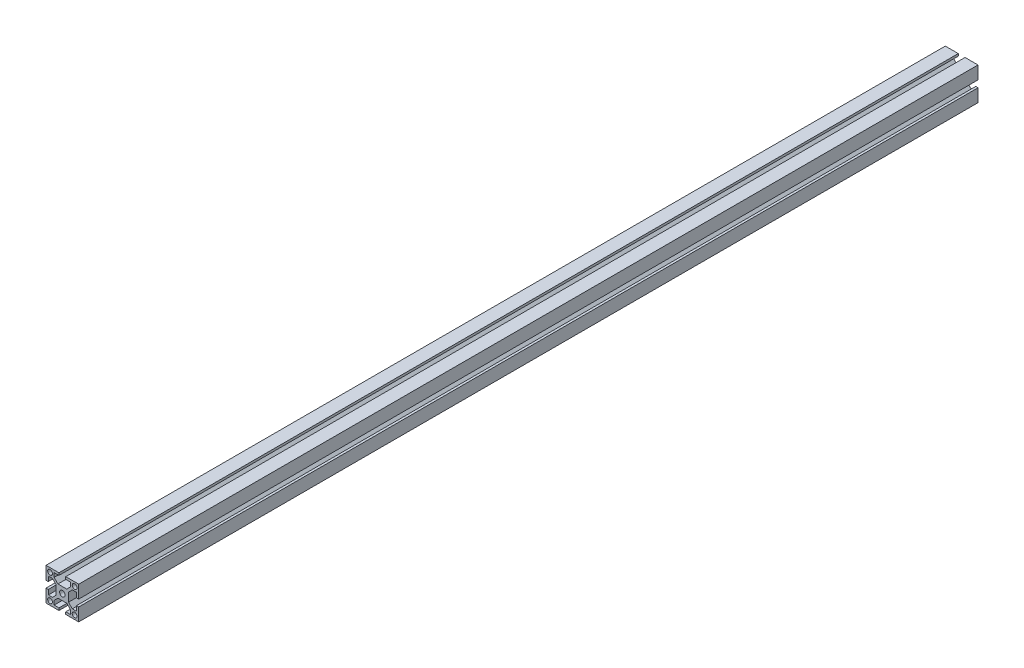
from build123d import *

# Parameters (mm, degrees)
SKETCH_1_R      = 3.4
SKETCH_1_R_2    = 2.95
EXTRUDE_1_DEPTH = 1100


with BuildPart() as part:
    # 草图1 → 凸台-拉伸1 (new body)
    with BuildSketch(Plane.XY):
        Polygon((-19.086731265, -5.57298703), (-8.329371952, -5.57298703), (-3.658051608, -10.244307374), (-3.658051608, -15.27298703), (-9.558051608, -15.27298703), (-9.558051608, -18.07298703), (6.291948392, -18.07298703), (6.291948392, -2.22298703), (3.491948392, -2.22298703), (3.491948392, -8.12298703), (-1.536731265, -8.12298703), (-6.208051608, -3.451666687), (-6.208051608, 7.305692626), (-1.536731265, 11.97701297), (3.491948392, 11.97701297), (3.491948392, 6.07701297), (6.291948392, 6.07701297), (6.291948392, 21.92701297), (-9.558051608, 21.92701297), (-9.558051608, 19.12701297), (-3.658051608, 19.12701297), (-3.658051608, 14.098333313), (-8.329371952, 9.42701297), (-19.086731265, 9.42701297), (-23.758051608, 14.098333313), (-23.758051608, 19.12701297), (-17.858051608, 19.12701297), (-17.858051608, 21.92701297), (-33.708051608, 21.92701297), (-33.708051608, 6.07701297), (-30.908051608, 6.07701297), (-30.908051608, 11.97701297), (-25.879371952, 11.97701297), (-21.208051608, 7.305692626), (-21.208051608, -3.451666687), (-25.879371952, -8.12298703), (-30.908051608, -8.12298703), (-30.908051608, -2.22298703), (-33.708051608, -2.22298703), (-33.708051608, -18.07298703), (-17.858051608, -18.07298703), (-17.858051608, -15.27298703), (-23.758051608, -15.27298703), (-23.758051608, -10.244307374), align=None)
        with Locations((-13.708051608, 1.92701297)):
            Circle(SKETCH_1_R, mode=Mode.SUBTRACT)
        with Locations((1.316948392, 16.95201297)):
            Circle(SKETCH_1_R_2, mode=Mode.SUBTRACT)
        with Locations(Location((-28.733051608, 16.95201297, 0), (0, 0, 180))):
            Circle(SKETCH_1_R_2, mode=Mode.SUBTRACT)
        with Locations((-28.733051608, -13.09798703)):
            Circle(SKETCH_1_R_2, mode=Mode.SUBTRACT)
        with Locations(Location((1.316948392, -13.09798703, 0), (0, 0, 180))):
            Circle(SKETCH_1_R_2, mode=Mode.SUBTRACT)
    extrude(amount=EXTRUDE_1_DEPTH)


solid = part.part
